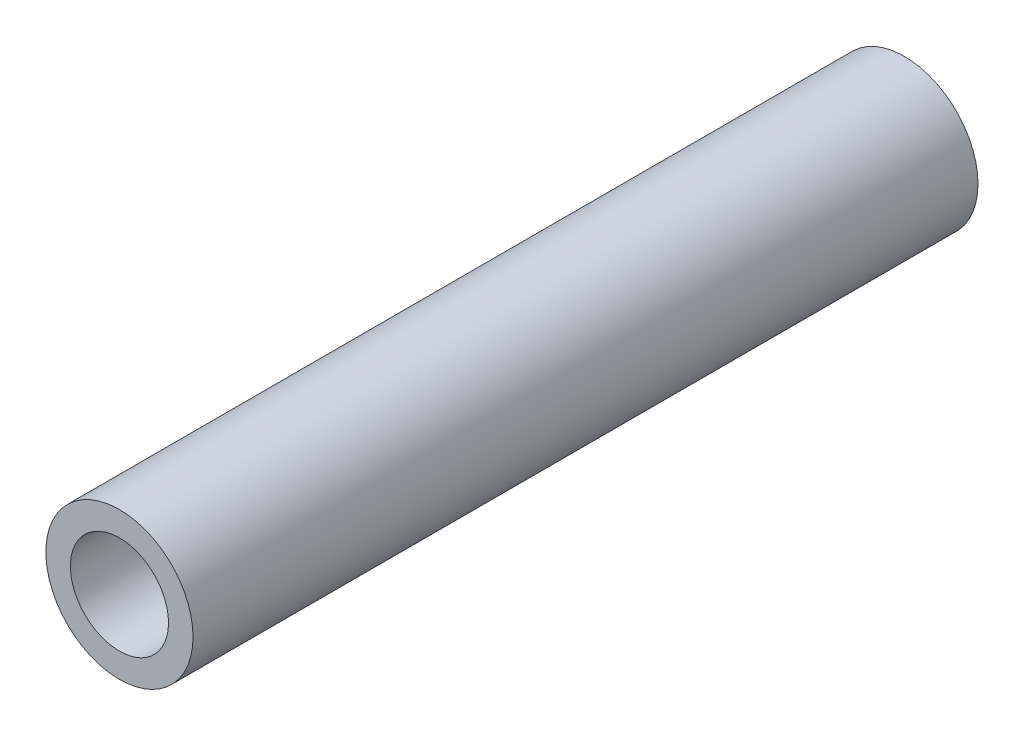
from build123d import *

# Parameters (mm, degrees)
SKETCH_1_R          = 1.5
EXTRUDE_1_DEPTH     = 16
SKETCH_2_R          = 1
CUT_EXTRUDE_1_DEPTH = 16


with BuildPart() as part:
    # 草图1 → 凸台-拉伸1 (new body)
    with BuildSketch(Plane.XY):
        Circle(SKETCH_1_R)
    extrude(amount=EXTRUDE_1_DEPTH)

    # 草图2 → 切除-拉伸1 (cut)
    with BuildSketch(Plane.XY.offset(16)):
        Circle(SKETCH_2_R)
    extrude(amount=-CUT_EXTRUDE_1_DEPTH, mode=Mode.SUBTRACT)


solid = part.part
